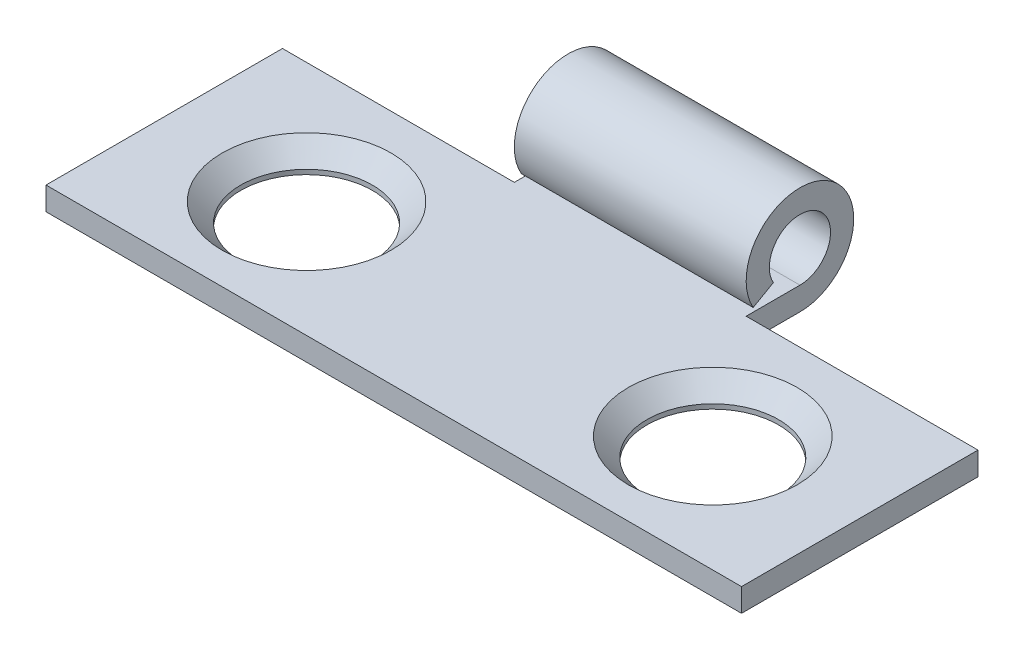
from build123d import *

# Parameters (mm, degrees)
BOSS_EXTRUDE1_DEPTH     = 9.525
CUT_EXTRUDE1_DEPTH      = 13.494063522
CUT_EXTRUDE1_DEPTH_BACK = 13.494063522
SKETCH4_W               = 6.35
SKETCH4_H               = 2.9464
CUT_EXTRUDE3_DEPTH      = 13.494063522
CUT_EXTRUDE3_DEPTH_BACK = 13.494063522
SKETCH9_R               = 1.8034


with BuildPart() as part:
    # Sketch3 → Boss-Extrude1 (new, symmetric)
    with BuildSketch(Plane(origin=(0, 0, 0), x_dir=(0, 0, -1), z_dir=(1, 0, 0))):
        with BuildLine():
            Line((0, -1.4732), (-7.9502, -1.4732))
            Line((-7.9502, -1.4732), (-7.9502, -0.8382))
            Line((-7.9502, -0.8382), (0, -0.8382))
            ThreePointArc((0, -0.8382), (0.421388638, 0.724576328), (-0.728533124, -0.414510226))
            Line((-0.728533124, -0.414510226), (-1.280452157, -0.728533124))
            ThreePointArc((-1.280452157, -0.728533124), (0.740622455, 1.273497789), (0, -1.4732))
        make_face()
    extrude(amount=BOSS_EXTRUDE1_DEPTH, both=True)

    # Sketch4 → Cut-Extrude1 (cut, two sides: drawn at the far end of the back side and taken through both)
    with BuildSketch(Plane(origin=(0, 0, 0), x_dir=(1, 0, 0), z_dir=(0, 1, 0)).offset(-CUT_EXTRUDE1_DEPTH_BACK)):
        with Locations((-6.35, 0)):
            Rectangle(SKETCH4_W, SKETCH4_H)
        with Locations((6.35, 0)):
            Rectangle(SKETCH4_W, SKETCH4_H)
    extrude(amount=CUT_EXTRUDE1_DEPTH + CUT_EXTRUDE1_DEPTH_BACK, mode=Mode.SUBTRACT)

    # Cut-Extrude2 cone 1 section (through the dimple's axis) → Cut-Extrude2 (revolve, cut)
    with BuildSketch(Plane(origin=(5.5626, -0.8382, 4.7752), x_dir=(0, 0, 1), z_dir=(1, 0, 0))):
        Polygon((0, 0), (2.3114, 0), (0, 2.3114), align=None)
    revolve(axis=Axis((5.5626, -0.8382, 4.7752), (0, -1, 0)), mode=Mode.SUBTRACT)

    # Cut-Extrude2 cone 2 section (through the dimple's axis) → Cut-Extrude2 cone 2 (revolve, cut)
    with BuildSketch(Plane(origin=(-5.5626, -0.8382, 4.7752), x_dir=(0, 0, 1), z_dir=(1, 0, 0))):
        Polygon((0, 0), (2.3114, 0), (0, 2.3114), align=None)
    revolve(axis=Axis((-5.5626, -0.8382, 4.7752), (0, -1, 0)), mode=Mode.SUBTRACT)

    # Sketch9 → Cut-Extrude3 (cut, two sides: drawn at the far end of the back side and taken through both)
    with BuildSketch(Plane(origin=(0, 0, 0), x_dir=(1, 0, 0), z_dir=(0, 1, 0)).offset(-CUT_EXTRUDE3_DEPTH_BACK)):
        with Locations(Location((5.5626, -4.7752, 0), (0, 0, 270))):
            Circle(SKETCH9_R)
        with Locations(Location((-5.5626, -4.7752, 0), (0, 0, 270))):
            Circle(SKETCH9_R)
    extrude(amount=CUT_EXTRUDE3_DEPTH + CUT_EXTRUDE3_DEPTH_BACK, mode=Mode.SUBTRACT)


solid = part.part
